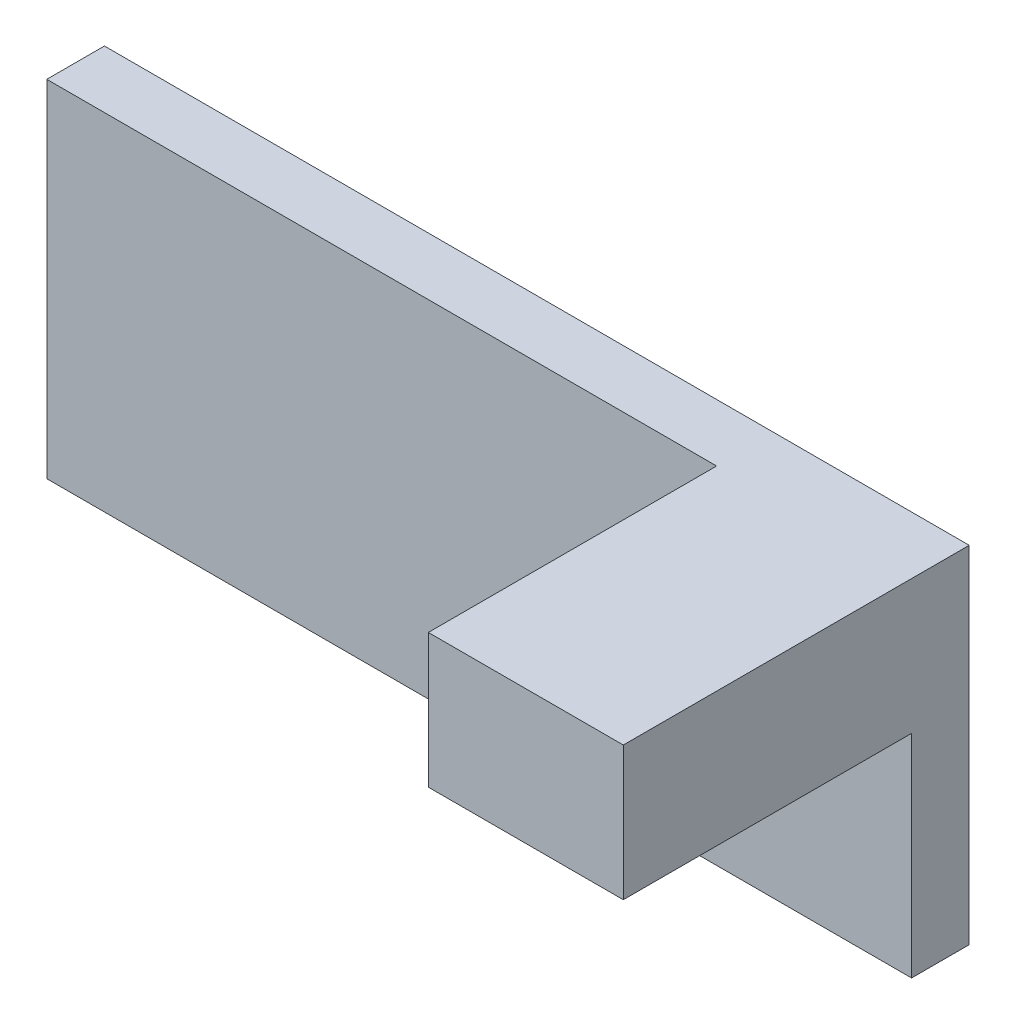
from build123d import *

# Parameters (mm, degrees)
SKETCH_3_W      = 150
SKETCH_3_H      = 60
EXTRUDE_3_DEPTH = 10
SKETCH_4_W      = 33.816093831
SKETCH_4_H      = 23.245668144
EXTRUDE_4_DEPTH = 50


with BuildPart() as part:
    # 草图3 → 凸台-拉伸3 (new body)
    with BuildSketch(Plane.XY):
        Rectangle(SKETCH_3_W, SKETCH_3_H)
    extrude(amount=EXTRUDE_3_DEPTH)

    # 草图4 → 凸台-拉伸4 (add)
    with BuildSketch(Plane.XY.offset(10)):
        with Locations((58.091953085, 18.377165928)):
            Rectangle(SKETCH_4_W, SKETCH_4_H)
    extrude(amount=EXTRUDE_4_DEPTH)


solid = part.part
